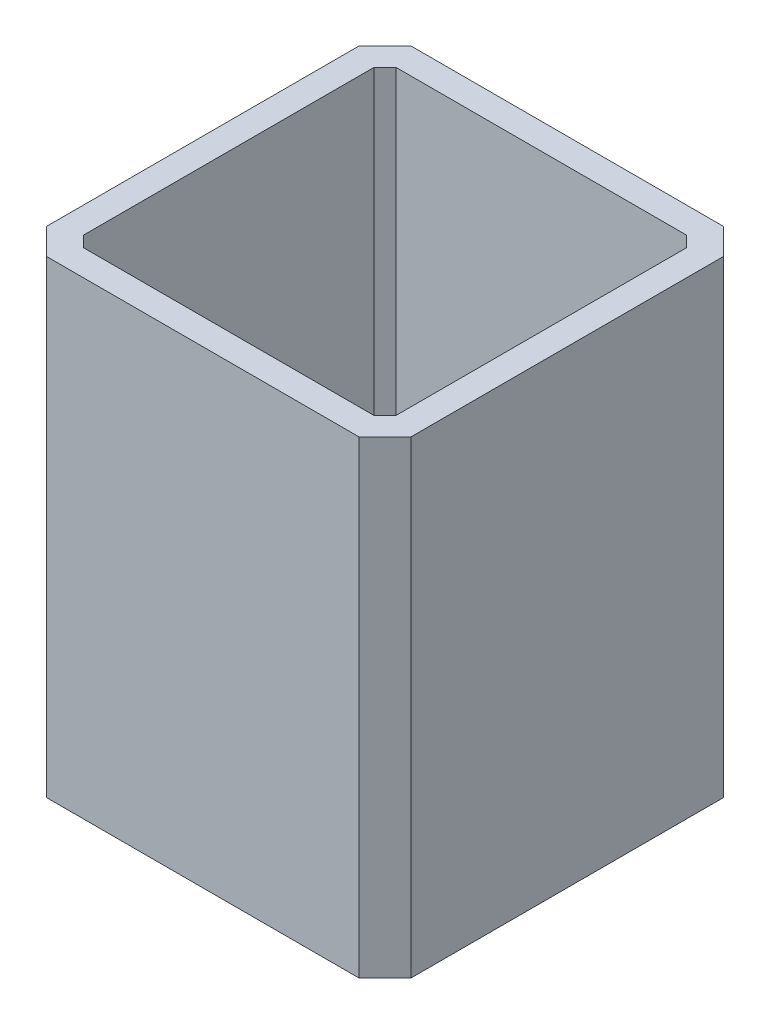
from build123d import *

# Parameters (mm, degrees)
BOSS_EXTRUDE1_DEPTH = 18
SHELL4_T            = -1


with BuildPart() as part:
    # Sketch1 → Boss-Extrude1 (new body)
    with BuildSketch(Plane(origin=(0, 0, 0), x_dir=(1, 0, 0), z_dir=(0, 1, 0))):
        Polygon((0, 13), (1, 14), (13, 14), (14, 13), (14, 1), (13, 0), (1, 0), (0, 1), align=None)
    extrude(amount=BOSS_EXTRUDE1_DEPTH)

    # Shell4
    shell4_openings = [part.faces().sort_by_distance(p)[0] for p in [
        (7, 18, -7),
    ]]
    offset(amount=SHELL4_T, openings=shell4_openings, kind=Kind.INTERSECTION)


solid = part.part
